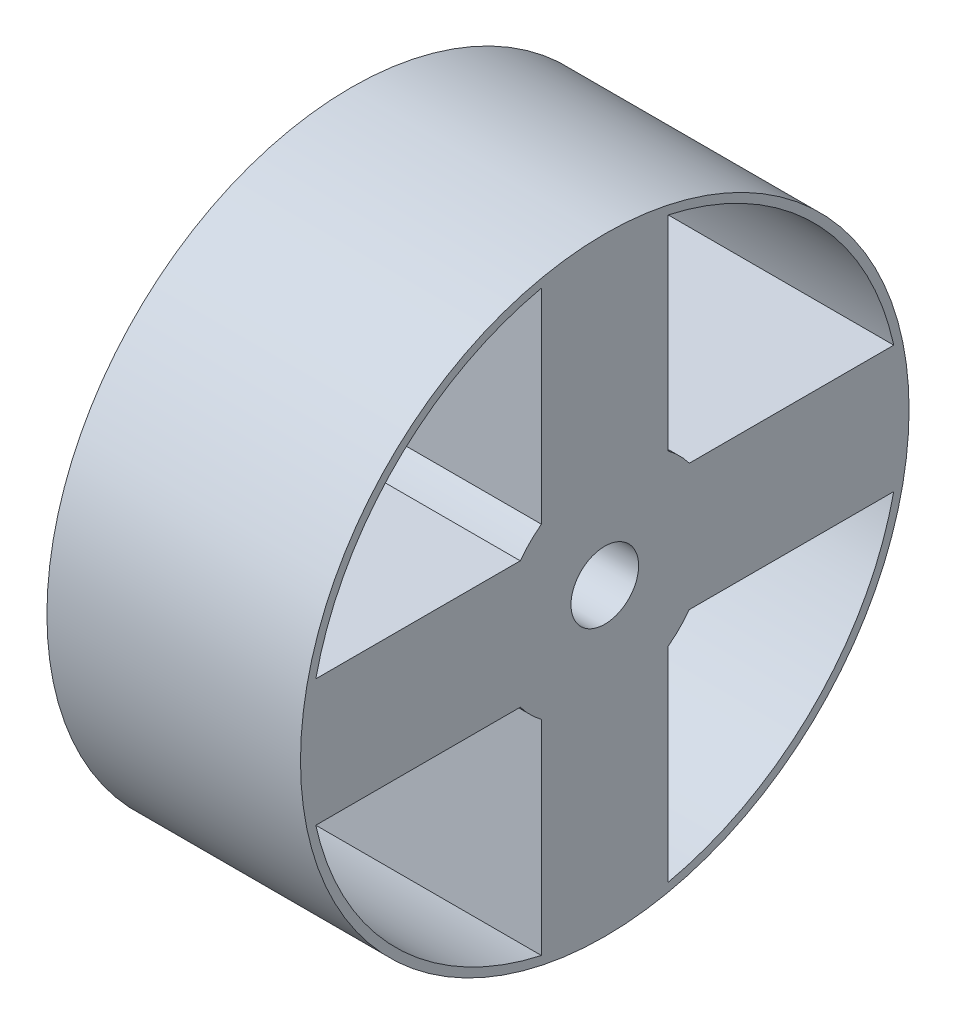
from build123d import *

# Parameters (mm, degrees)
BOSS_EXTRUDE1_DEPTH = 76.2
BOSS_EXTRUDE2_START = -76.2
SKETCH2_R           = 91.44
SKETCH2_R_2         = 88.9
BOSS_EXTRUDE2_DEPTH = 76.2
SKETCH3_R           = 10.16
CUT_EXTRUDE1_DEPTH  = 88.9


with BuildPart() as part:
    # Sketch1 → Boss-Extrude1 (new body)
    with BuildSketch(Plane(origin=(0, 0, 0), x_dir=(0, 0, -1), z_dir=(1, 0, 0))):
        with BuildLine():
            Line((-86.834944003, 19.05), (-25.4, 19.05))
            ThreePointArc((-25.4, 19.05), (-22.450640303, 22.450640303), (-19.05, 25.4))
            Line((-19.05, 25.4), (-19.05, 86.834944003))
            ThreePointArc((-19.05, 86.834944003), (0, 88.9), (19.05, 86.834944003))
            Line((19.05, 86.834944003), (19.05, 25.4))
            ThreePointArc((19.05, 25.4), (22.450640303, 22.450640303), (25.4, 19.05))
            Line((25.4, 19.05), (86.834944003, 19.05))
            ThreePointArc((86.834944003, 19.05), (88.9, 0), (86.834944003, -19.05))
            Line((86.834944003, -19.05), (25.4, -19.05))
            ThreePointArc((25.4, -19.05), (22.450640303, -22.450640303), (19.05, -25.4))
            Line((19.05, -25.4), (19.05, -86.834944003))
            ThreePointArc((19.05, -86.834944003), (0, -88.9), (-19.05, -86.834944003))
            Line((-19.05, -86.834944003), (-19.05, -25.4))
            ThreePointArc((-19.05, -25.4), (-22.450640303, -22.450640303), (-25.4, -19.05))
            Line((-25.4, -19.05), (-86.834944003, -19.05))
            ThreePointArc((-86.834944003, -19.05), (-88.9, 0), (-86.834944003, 19.05))
        make_face()
    extrude(amount=BOSS_EXTRUDE1_DEPTH)

    # Sketch2 → Boss-Extrude2 (add)
    with BuildSketch(Plane(origin=(76.2, 0, 0), x_dir=(0, 0, -1), z_dir=(1, 0, 0)).offset(BOSS_EXTRUDE2_START)):
        Circle(SKETCH2_R)
        Circle(SKETCH2_R_2, mode=Mode.SUBTRACT)
    extrude(amount=BOSS_EXTRUDE2_DEPTH)

    # Sketch3 → Cut-Extrude1 (cut)
    with BuildSketch(Plane(origin=(76.2, 0, 0), x_dir=(0, 0, -1), z_dir=(1, 0, 0))):
        Circle(SKETCH3_R)
    extrude(amount=-CUT_EXTRUDE1_DEPTH, mode=Mode.SUBTRACT)


solid = part.part
